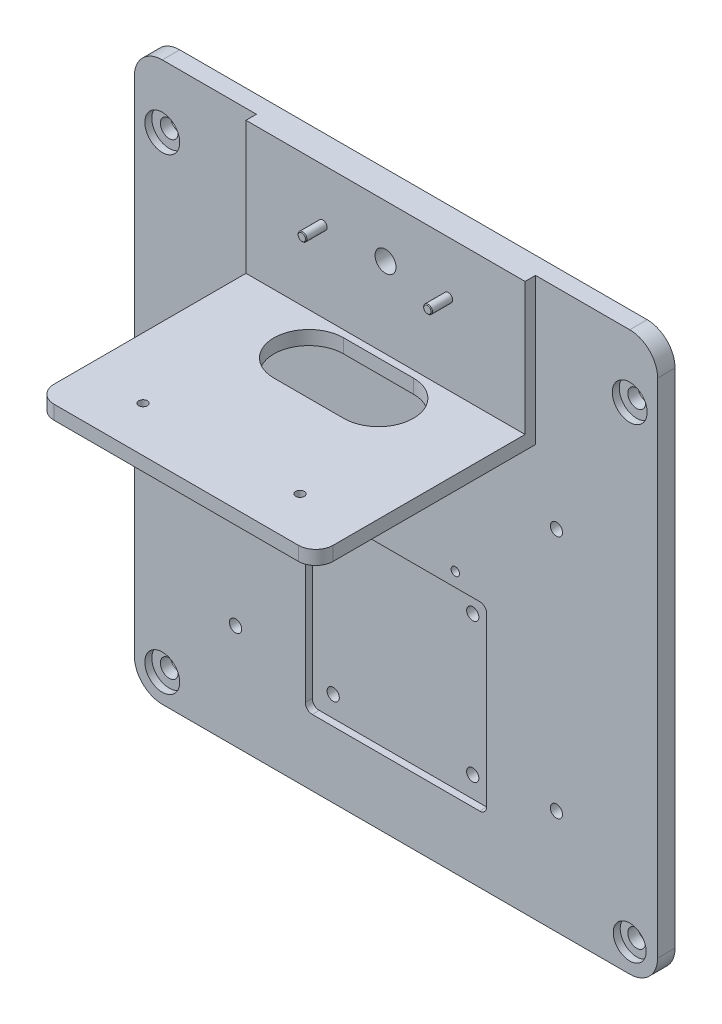
from build123d import *

# Parameters (mm, degrees)
SKETCH_1_W                = 150
SKETCH_1_H                = 160
EXTRUDE_1_DEPTH           = 5
SKETCH_2_R                = 1.75
CUT_EXTRUDE_1_DEPTH       = 110.772492001
SKETCH_3_R                = 1.75
CUT_EXTRUDE_2_DEPTH       = 110.772492001
SKETCH_4_R                = 2.55
CUT_EXTRUDE_3_DEPTH       = 7
FILLET_1_R                = 8
SKETCH_5_R                = 2.55
CUT_EXTRUDE_4_DEPTH       = 110.772492001
EXTRUDE_2_DEPTH           = 40
SKETCH_7_R                = 5
SKETCH_7_R_2              = 4.71820485
CUT_EXTRUDE_5_DEPTH       = 2
CUT_EXTRUDE_6_DEPTH       = 159.533908045
CUT_EXTRUDE_6_DEPTH_BACK  = 159.533908045
SKETCH_9_R                = 1.25
CUT_EXTRUDE_7_DEPTH       = 159.533908045
CUT_EXTRUDE_7_DEPTH_BACK  = 159.533908045
SKETCH_11_R               = 3
CUT_EXTRUDE_8_DEPTH       = 130.031004026
SKETCH_12_R               = 1.25
EXTRUDE_3_DEPTH           = 6
SKETCH_13_W               = 52
SKETCH_13_H               = 52
CUT_EXTRUDE_9_DEPTH       = 2
CUT_EXTRUDE_10_DEPTH      = 130.031004026
CUT_EXTRUDE_10_DEPTH_BACK = 5
SKETCH_14_R               = 1.2
FILLET_2_R                = 2
FILLET_3_R                = 5
CHAMFER_1_SIZE            = 0.2


with BuildPart() as part:
    # 草图1 → 凸台-拉伸1 (new body)
    with BuildSketch(Plane.XY):
        Rectangle(SKETCH_1_W, SKETCH_1_H)
    extrude(amount=EXTRUDE_1_DEPTH)

    # 草图2 → 切除-拉伸1 (cut, through all)
    with BuildSketch(Plane.XY.offset(5)):
        with Locations((-20, -15)):
            Circle(SKETCH_2_R)
        with Locations((20, -15)):
            Circle(SKETCH_2_R)
        with Locations((20, -55)):
            Circle(SKETCH_2_R)
        with Locations((-20, -55)):
            Circle(SKETCH_2_R)
    extrude(amount=-CUT_EXTRUDE_1_DEPTH, mode=Mode.SUBTRACT)

    # 草图3 → 切除-拉伸2 (cut, through all)
    with BuildSketch(Plane.XY.offset(5)):
        with Locations((46, 20)):
            Circle(SKETCH_3_R)
        with Locations((46, -50)):
            Circle(SKETCH_3_R)
        with Locations((-46, -50)):
            Circle(SKETCH_3_R)
        with Locations((-46, 20)):
            Circle(SKETCH_3_R)
    extrude(amount=-CUT_EXTRUDE_2_DEPTH, mode=Mode.SUBTRACT)

    # 草图4 → 切除-拉伸3 (cut)
    with BuildSketch(Plane.XY.offset(5)):
        with Locations((-67, -72)):
            Circle(SKETCH_4_R)
        with Locations((67, -72)):
            Circle(SKETCH_4_R)
        with Locations((-67, 62)):
            Circle(SKETCH_4_R)
        with Locations((67, 62)):
            Circle(SKETCH_4_R)
    extrude(amount=-CUT_EXTRUDE_3_DEPTH, mode=Mode.SUBTRACT)

    # 圆角1
    fillet_1_edges = [part.edges().sort_by_distance(p)[0] for p in [
        (75, -80, 2.5),
        (-75, -80, 2.5),
        (-75, 80, 2.5),
        (75, 80, 2.5),
    ]]
    fillet(fillet_1_edges, radius=FILLET_1_R)

    # 草图5 → 切除-拉伸4 (cut, through all)
    with BuildSketch(Plane.XY.offset(5)):
        with Locations((0, 65)):
            Circle(SKETCH_5_R)
    extrude(amount=-CUT_EXTRUDE_4_DEPTH, mode=Mode.SUBTRACT)

    # 草图6 → 凸台-拉伸2 (add, symmetric)
    with BuildSketch(Plane(origin=(0, 0, 0), x_dir=(0, 0, -1), z_dir=(1, 0, 0))):
        Polygon((-5, 80), (-5, 38), (-68, 38), (-68, 42), (-8, 42), (-8, 80), align=None)
    extrude(amount=EXTRUDE_2_DEPTH, both=True)

    # 草图7 → 切除-拉伸5 (cut)
    with BuildSketch(Plane.XY.offset(5)):
        with Locations((67, 62)):
            Circle(SKETCH_7_R)
        with Locations((-67, 62)):
            Circle(SKETCH_7_R)
        with Locations((67, -72)):
            Circle(SKETCH_7_R_2)
        with Locations((-67, -72)):
            Circle(SKETCH_7_R)
    extrude(amount=-CUT_EXTRUDE_5_DEPTH, mode=Mode.SUBTRACT)

    # 草图9 → 切除-拉伸6 (cut, two sides: drawn at the far end of the back side and taken through both)
    with BuildSketch(Plane(origin=(0, 42, 0), x_dir=(1, 0, 0), z_dir=(0, 1, 0)).offset(-CUT_EXTRUDE_6_DEPTH_BACK)):
        with Locations(Location((22.5, -55, 0), (0, 0, 270))):
            Circle(SKETCH_9_R)
        with Locations(Location((-22.5, -55, 0), (0, 0, 270))):
            Circle(SKETCH_9_R)
    extrude(amount=CUT_EXTRUDE_6_DEPTH + CUT_EXTRUDE_6_DEPTH_BACK, mode=Mode.SUBTRACT)

    # 草图10 → 切除-拉伸7 (cut, two sides: drawn at the far end of the back side and taken through both)
    with BuildSketch(Plane(origin=(0, 42, 0), x_dir=(1, 0, 0), z_dir=(0, 1, 0)).offset(-CUT_EXTRUDE_7_DEPTH_BACK)):
        with BuildLine():
            Line((10, -30), (-10, -30))
            ThreePointArc((-10, -30), (-20, -20), (-10, -10))
            Line((-10, -10), (10, -10))
            ThreePointArc((10, -10), (20, -20), (10, -30))
        make_face()
    extrude(amount=CUT_EXTRUDE_7_DEPTH + CUT_EXTRUDE_7_DEPTH_BACK, mode=Mode.SUBTRACT)

    # 草图11 → 切除-拉伸8 (cut, through all)
    with BuildSketch(Plane(origin=(0, 0, 0), x_dir=(-1, 0, 0), z_dir=(0, 0, -1))):
        with Locations((0, 65)):
            Circle(SKETCH_11_R)
    extrude(amount=-CUT_EXTRUDE_8_DEPTH, mode=Mode.SUBTRACT)

    # 草图12 → 凸台-拉伸3 (add)
    with BuildSketch(Plane.XY.offset(8)):
        with Locations(Location((18, 65, 0), (0, 0, 90))):
            Circle(SKETCH_12_R)
        with Locations(Location((-18, 65, 0), (0, 0, 180))):
            Circle(SKETCH_12_R)
    extrude(amount=EXTRUDE_3_DEPTH)

    # 草图13 → 切除-拉伸9 (cut)
    with BuildSketch(Plane.XY.offset(5)):
        with Locations((0, -35)):
            Rectangle(SKETCH_13_W, SKETCH_13_H)
    extrude(amount=-CUT_EXTRUDE_9_DEPTH, mode=Mode.SUBTRACT)

    # 草图14 → 切除-拉伸10 (cut, two sides: drawn at the far end of the back side and taken through both)
    with BuildSketch(Plane(origin=(0, 0, 0), x_dir=(-1, 0, 0), z_dir=(0, 0, -1)).offset(-CUT_EXTRUDE_10_DEPTH_BACK)):
        with Locations(Location((17, -5, 0), (0, 0, 180))):
            Circle(SKETCH_14_R)
        with Locations(Location((17, 56, 0), (0, 0, 180))):
            Circle(SKETCH_14_R)
        with Locations(Location((-17, 56, 0), (0, 0, 180))):
            Circle(SKETCH_14_R)
        with Locations(Location((-17, -5, 0), (0, 0, 180))):
            Circle(SKETCH_14_R)
    extrude(amount=CUT_EXTRUDE_10_DEPTH + CUT_EXTRUDE_10_DEPTH_BACK, mode=Mode.SUBTRACT)

    # 圆角2
    fillet_2_edges = [part.edges().sort_by_distance(p)[0] for p in [
        (26, -9, 4),
        (26, -61, 4),
        (-26, -61, 4),
        (-26, -9, 4),
    ]]
    fillet(fillet_2_edges, radius=FILLET_2_R)

    # 圆角3
    fillet_3_edges = [part.edges().sort_by_distance(p)[0] for p in [
        (-40, 40, 68),
        (40, 40, 68),
    ]]
    fillet(fillet_3_edges, radius=FILLET_3_R)

    # 倒角1
    chamfer_1_edges = [part.edges().sort_by_distance(p)[0] for p in [
        (18, 63.75, 14),
        (-16.75, 65, 14),
    ]]
    chamfer(chamfer_1_edges, length=CHAMFER_1_SIZE)


solid = part.part
